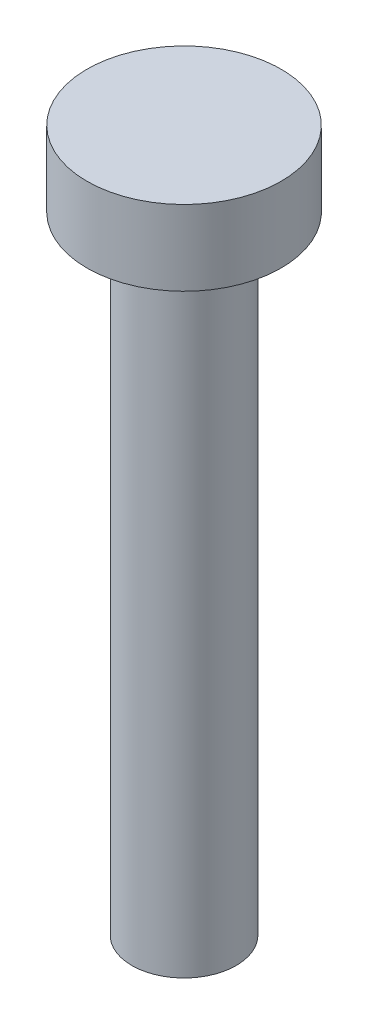
from build123d import *

# Parameters (mm, degrees)
SKETCH_1_R      = 2.5
EXTRUDE_1_DEPTH = 30
SKETCH_2_R      = 4.65
EXTRUDE_2_DEPTH = 3.6


with BuildPart() as part:
    # 草图1 → 凸台-拉伸1 (new body)
    with BuildSketch(Plane(origin=(0, 0, 0), x_dir=(1, 0, 0), z_dir=(0, 1, 0))):
        with Locations(Location((0, 0, 0), (0, 0, 270))):
            Circle(SKETCH_1_R)
    extrude(amount=EXTRUDE_1_DEPTH)

    # 草图2 → 凸台-拉伸2 (add)
    with BuildSketch(Plane(origin=(0, 30, 0), x_dir=(1, 0, 0), z_dir=(0, 1, 0))):
        with Locations(Location((0, 0, 0), (0, 0, 270))):
            Circle(SKETCH_2_R)
    extrude(amount=EXTRUDE_2_DEPTH)


solid = part.part
